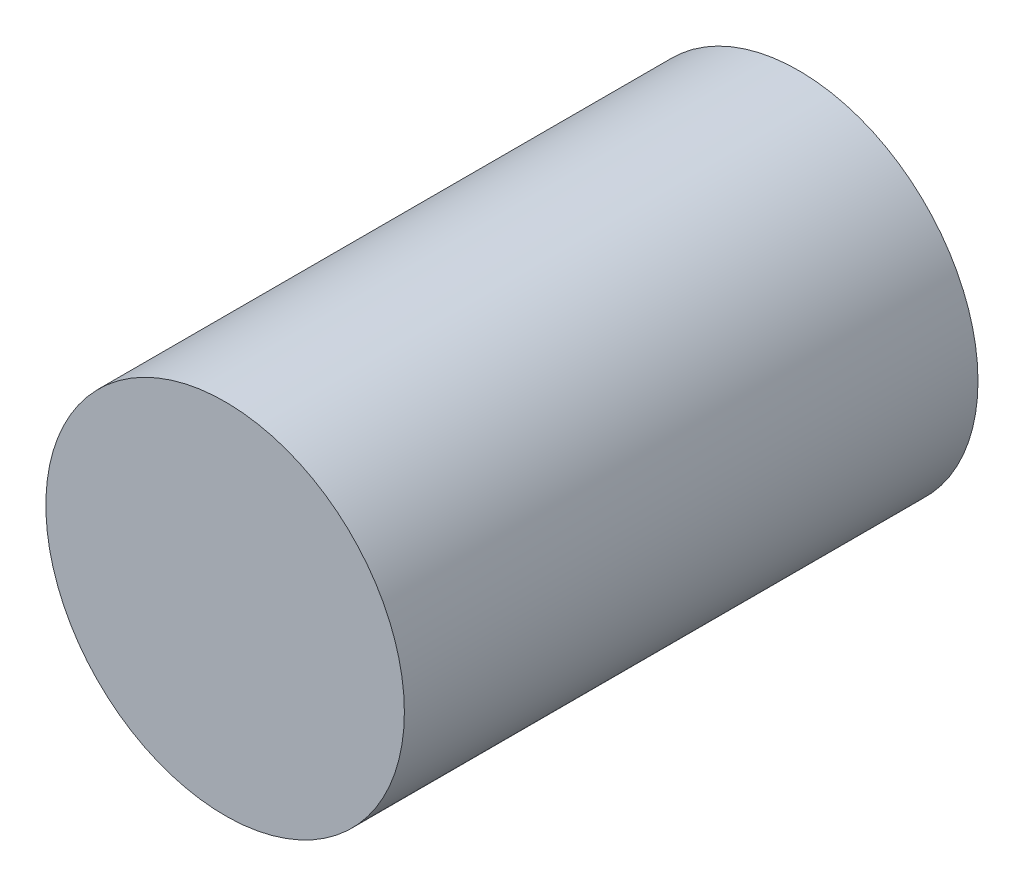
from build123d import *

# Parameters (mm, degrees)
SKETCH_1_R      = 1.5
EXTRUDE_1_DEPTH = 4.8


with BuildPart() as part:
    # 草图1 → 凸台-拉伸1 (new body)
    with BuildSketch(Plane.XY):
        Circle(SKETCH_1_R)
    extrude(amount=EXTRUDE_1_DEPTH)


solid = part.part
